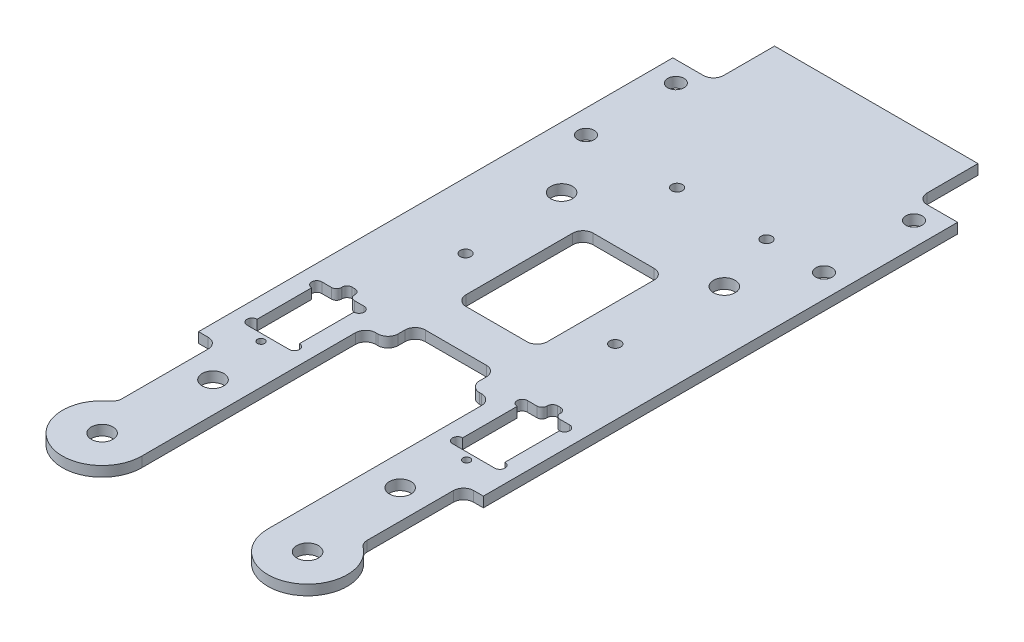
from build123d import *

# Parameters (mm, degrees)
SKETCH1_W           = 88.9
SKETCH1_H           = 228.6
BOSS_EXTRUDE1_DEPTH = 3.175
SKETCH12_R          = 3.3782
SKETCH12_W          = 39.37
SKETCH12_H          = 63.5
CUT_EXTRUDE13_DEPTH = 123.679962198
SKETCH14_R          = 2.5527
CUT_EXTRUDE15_DEPTH = 123.679962198
SKETCH15_W          = 88.9
SKETCH15_H          = 57.15
CUT_EXTRUDE16_DEPTH = 123.679962198
FILLET1_R           = 3.175
SKETCH18_R          = 1.6891
CUT_EXTRUDE18_DEPTH = 123.679962198
SKETCH16_R          = 3.3782
BOSS_EXTRUDE2_DEPTH = 3.175
SKETCH19_R          = 3.3782
CUT_EXTRUDE19_DEPTH = 123.679962198
SKETCH20_R          = 1.143
CUT_EXTRUDE20_DEPTH = 123.679962198
SKETCH21_W          = 88.9
SKETCH21_H          = 3.175
BOSS_EXTRUDE3_DEPTH = 19.05
CUT_EXTRUDE21_DEPTH = 141.599095392
CUT_EXTRUDE22_DEPTH = 141.599095392


with BuildPart() as part:
    # Sketch1 → Boss-Extrude1 (new body)
    with BuildSketch(Plane(origin=(0, 0, 0), x_dir=(1, 0, 0), z_dir=(0, 1, 0))):
        Rectangle(SKETCH1_W, SKETCH1_H)
    extrude(amount=BOSS_EXTRUDE1_DEPTH)

    # Sketch12 → Cut-Extrude13 (cut, through all)
    with BuildSketch(Plane(origin=(0, 3.175, 0), x_dir=(1, 0, 0), z_dir=(0, 1, 0))):
        with Locations(Location((29.21, -44.45, 0), (0, 0, 270))):
            Circle(SKETCH12_R)
        with Locations(Location((-29.21, -44.45, 0), (0, 0, 90))):
            Circle(SKETCH12_R)
        with Locations((0, -38.1)):
            Rectangle(SKETCH12_W, SKETCH12_H)
    extrude(amount=-CUT_EXTRUDE13_DEPTH, mode=Mode.SUBTRACT)

    # Sketch14 → Cut-Extrude15 (cut, through all)
    with BuildSketch(Plane(origin=(0, 0, 0), x_dir=(-1, 0, 0), z_dir=(0, -1, 0))):
        with Locations(Location((-37.1475, 107.95, 0), (0, 0, 90))):
            Circle(SKETCH14_R)
        with Locations(Location((-37.1475, 79.883, 0), (0, 0, 270))):
            Circle(SKETCH14_R)
        with Locations(Location((37.1475, 107.95, 0), (0, 0, 270))):
            Circle(SKETCH14_R)
        with Locations(Location((37.1475, 79.883, 0), (0, 0, 90))):
            Circle(SKETCH14_R)
    extrude(amount=-CUT_EXTRUDE15_DEPTH, mode=Mode.SUBTRACT)

    # Sketch15 → Cut-Extrude16 (cut, through all)
    with BuildSketch(Plane.XZ):
        with Locations((0, 85.725)):
            Rectangle(SKETCH15_W, SKETCH15_H)
        with BuildLine():
            Line((12.7, -51.308), (12.7, -17.991666667))
            ThreePointArc((12.7, -17.991666667), (11.77006403, -15.746602636), (9.525, -14.816666667))
            Line((9.525, -14.816666667), (-9.525, -14.816666667))
            ThreePointArc((-9.525, -14.816666667), (-11.77006403, -15.746602636), (-12.7, -17.991666667))
            Line((-12.7, -17.991666667), (-12.7, -51.308))
            ThreePointArc((-12.7, -51.308), (-11.77006403, -53.55306403), (-9.525, -54.483))
            Line((-9.525, -54.483), (9.525, -54.483))
            ThreePointArc((9.525, -54.483), (11.77006403, -53.55306403), (12.7, -51.308))
        make_face()
        with BuildLine():
            Line((12.7, 6.35), (-12.7, 6.35))
            Line((-12.7, 6.35), (-12.7, 1.058333333))
            ThreePointArc((-12.7, 1.058333333), (-11.77006403, -1.186730697), (-9.525, -2.116666667))
            Line((-9.525, -2.116666667), (9.525, -2.116666667))
            ThreePointArc((9.525, -2.116666667), (11.77006403, -1.186730697), (12.7, 1.058333333))
            Line((12.7, 1.058333333), (12.7, 6.35))
        make_face()
    extrude(amount=-CUT_EXTRUDE16_DEPTH, mode=Mode.SUBTRACT)

    # Fillet1
    fillet1_edges = [part.edges().sort_by_distance(p)[0] for p in [
        (19.685, 1.5875, 6.35),
        (-19.685, 1.5875, 6.35),
        (-12.7, 1.5875, 6.35),
        (12.7, 1.5875, 6.35),
    ]]
    fillet(fillet1_edges, radius=FILLET1_R)

    # Sketch18 → Cut-Extrude18 (cut, through all)
    with BuildSketch(Plane(origin=(0, 3.175, 0), x_dir=(1, 0, 0), z_dir=(0, 1, 0))):
        with Locations(Location((-23.9014, 29.083, 0), (0, 0, 270))):
            Circle(SKETCH18_R)
        with Locations(Location((23.9014, 27.98318, 0), (0, 0, 270))):
            Circle(SKETCH18_R)
        with Locations(Location((-8.70204, 79.883, 0), (0, 0, 270))):
            Circle(SKETCH18_R)
        with Locations(Location((19.19986, 79.883, 0), (0, 0, 270))):
            Circle(SKETCH18_R)
    extrude(amount=-CUT_EXTRUDE18_DEPTH, mode=Mode.SUBTRACT)

    # Sketch16 → Boss-Extrude2 (add)
    # profile 1 of 2: a face of its own
    with BuildSketch(Plane(origin=(0, 3.175, 0), x_dir=(1, 0, 0), z_dir=(0, 1, 0))):
        with BuildLine():
            Line((-44.45, -57.15), (-44.45, -76.2))
            ThreePointArc((-44.45, -76.2), (-32.0675, -88.5825), (-19.685, -76.2))
            Line((-19.685, -76.2), (-19.685, -57.15))
            Line((-19.685, -57.15), (-44.45, -57.15))
        make_face()
        with Locations(Location((-32.0675, -76.2, 0), (0, 0, 270))):
            Circle(SKETCH16_R, mode=Mode.SUBTRACT)
    # profile 2 of 2: a face of its own
    with BuildSketch(Plane(origin=(0, 3.175, 0), x_dir=(1, 0, 0), z_dir=(0, 1, 0))):
        with BuildLine():
            ThreePointArc((44.45, -76.2), (32.0675, -88.5825), (19.685, -76.2))
            Line((19.685, -76.2), (19.685, -57.15))
            Line((19.685, -57.15), (44.45, -57.15))
            Line((44.45, -57.15), (44.45, -76.2))
        make_face()
        with Locations(Location((32.0675, -76.2, 0), (0, 0, 270))):
            Circle(SKETCH16_R, mode=Mode.SUBTRACT)
    extrude(amount=-BOSS_EXTRUDE2_DEPTH)

    # Sketch19 → Cut-Extrude19 (cut, through all)
    with BuildSketch(Plane(origin=(0, 3.175, 0), x_dir=(1, 0, 0), z_dir=(0, 1, 0))):
        with Locations(Location((-25.4, 60.536666667, 0), (0, 0, 270))):
            Circle(SKETCH19_R)
        with Locations(Location((25.4, 60.536666667, 0), (0, 0, 90))):
            Circle(SKETCH19_R)
    extrude(amount=-CUT_EXTRUDE19_DEPTH, mode=Mode.SUBTRACT)

    # Sketch20 → Cut-Extrude20 (cut, through all)
    with BuildSketch(Plane(origin=(0, 3.175, 0), x_dir=(1, 0, 0), z_dir=(0, 1, 0))):
        with Locations(Location((-32.0675, -26.58657951, 0), (0, 0, 270))):
            Circle(SKETCH20_R)
        with Locations(Location((32.0675, -26.58657951, 0), (0, 0, 90))):
            Circle(SKETCH20_R)
        with BuildLine():
            Line((-25.4635, -24.384), (-38.6715, -24.384))
            ThreePointArc((-38.6715, -24.384), (-40.259, -22.7965), (-38.6715, -21.209))
            Line((-38.6715, -21.209), (-38.6715, -4.191))
            ThreePointArc((-38.6715, -4.191), (-40.259, -2.6035), (-38.6715, -1.016))
            Line((-38.6715, -1.016), (-35.687, -1.016))
            ThreePointArc((-35.687, -1.016), (-34.564467985, -0.551032015), (-34.0995, 0.5715))
            Line((-34.0995, 0.5715), (-34.0995, 0.6985))
            ThreePointArc((-34.0995, 0.6985), (-33.634532015, 1.821032015), (-32.512, 2.286))
            Line((-32.512, 2.286), (-31.623, 2.286))
            ThreePointArc((-31.623, 2.286), (-30.500467985, 1.821032015), (-30.0355, 0.6985))
            Line((-30.0355, 0.6985), (-30.0355, 0.5715))
            ThreePointArc((-30.0355, 0.5715), (-29.570532015, -0.551032015), (-28.448, -1.016))
            Line((-28.448, -1.016), (-25.4635, -1.016))
            ThreePointArc((-25.4635, -1.016), (-23.876, -2.6035), (-25.4635, -4.191))
            Line((-25.4635, -4.191), (-25.4635, -21.209))
            ThreePointArc((-25.4635, -21.209), (-23.876, -22.7965), (-25.4635, -24.384))
        make_face()
        with BuildLine():
            Line((25.4635, -24.384), (38.6715, -24.384))
            ThreePointArc((38.6715, -24.384), (40.259, -22.7965), (38.6715, -21.209))
            Line((38.6715, -21.209), (38.6715, -4.191))
            ThreePointArc((38.6715, -4.191), (40.259, -2.6035), (38.6715, -1.016))
            Line((38.6715, -1.016), (35.687, -1.016))
            ThreePointArc((35.687, -1.016), (34.564467985, -0.551032015), (34.0995, 0.5715))
            Line((34.0995, 0.5715), (34.0995, 0.6985))
            ThreePointArc((34.0995, 0.6985), (33.634532015, 1.821032015), (32.512, 2.286))
            Line((32.512, 2.286), (31.623, 2.286))
            ThreePointArc((31.623, 2.286), (30.500467985, 1.821032015), (30.0355, 0.6985))
            Line((30.0355, 0.6985), (30.0355, 0.5715))
            ThreePointArc((30.0355, 0.5715), (29.570532015, -0.551032015), (28.448, -1.016))
            Line((28.448, -1.016), (25.4635, -1.016))
            ThreePointArc((25.4635, -1.016), (23.876, -2.6035), (25.4635, -4.191))
            Line((25.4635, -4.191), (25.4635, -21.209))
            ThreePointArc((25.4635, -21.209), (23.876, -22.7965), (25.4635, -24.384))
        make_face()
    extrude(amount=-CUT_EXTRUDE20_DEPTH, mode=Mode.SUBTRACT)

    # Sketch21 → Boss-Extrude3 (add)
    with BuildSketch(Plane(origin=(0, 0, -114.3), x_dir=(-1, 0, 0), z_dir=(0, 0, -1))):
        with Locations((0, 1.5875)):
            Rectangle(SKETCH21_W, SKETCH21_H)
    extrude(amount=BOSS_EXTRUDE3_DEPTH)

    # Sketch22 → Cut-Extrude21 (cut, through all)
    with BuildSketch(Plane(origin=(0, 3.175, 0), x_dir=(1, 0, 0), z_dir=(0, 1, 0))):
        with BuildLine():
            Line((-44.45, 133.35), (-31.75, 133.35))
            Line((-31.75, 133.35), (-31.75, 117.475))
            ThreePointArc((-31.75, 117.475), (-32.67993597, 115.22993597), (-34.925, 114.3))
            Line((-34.925, 114.3), (-44.45, 114.3))
            Line((-44.45, 114.3), (-44.45, 133.35))
        make_face()
        with BuildLine():
            Line((44.45, 114.3), (34.925, 114.3))
            ThreePointArc((34.925, 114.3), (32.67993597, 115.22993597), (31.75, 117.475))
            Line((31.75, 117.475), (31.75, 133.35))
            Line((31.75, 133.35), (44.45, 133.35))
            Line((44.45, 133.35), (44.45, 114.3))
        make_face()
    extrude(amount=-CUT_EXTRUDE21_DEPTH, mode=Mode.SUBTRACT)

    # Sketch23 → Cut-Extrude22 (cut, through all)
    with BuildSketch(Plane(origin=(0, 3.175, 0), x_dir=(1, 0, 0), z_dir=(0, 1, 0))):
        with BuildLine():
            Line((-38.25875, -63.777875899), (-38.25875, -36.901440438))
            ThreePointArc((-38.25875, -36.901440438), (-39.18868597, -34.656376407), (-41.43375, -33.726440438))
            Line((-41.43375, -33.726440438), (-44.45, -33.726440438))
            Line((-44.45, -33.726440438), (-44.45, -76.2))
            ThreePointArc((-44.45, -76.2), (-43.149805735, -70.676522306), (-39.522270408, -66.313003266))
            ThreePointArc((-39.522270408, -66.313003266), (-38.592133145, -65.194152231), (-38.25875, -63.777875899))
        make_face()
        with BuildLine():
            Line((41.43375, -33.726440438), (44.45, -33.726440438))
            Line((44.45, -33.726440438), (44.45, -76.2))
            ThreePointArc((44.45, -76.2), (43.149805735, -70.676522306), (39.522270408, -66.313003266))
            ThreePointArc((39.522270408, -66.313003266), (38.592133145, -65.194152231), (38.25875, -63.777875899))
            Line((38.25875, -63.777875899), (38.25875, -36.901440438))
            ThreePointArc((38.25875, -36.901440438), (39.18868597, -34.656376407), (41.43375, -33.726440438))
        make_face()
    extrude(amount=-CUT_EXTRUDE22_DEPTH, mode=Mode.SUBTRACT)


solid = part.part
